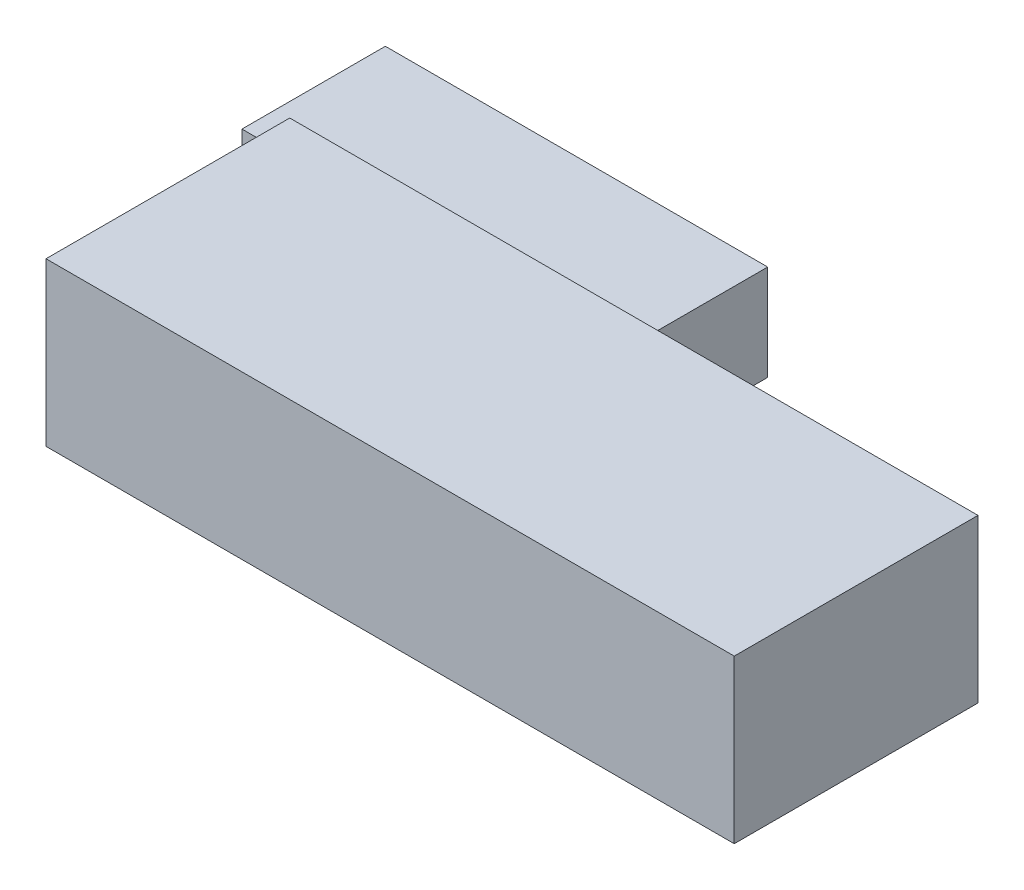
from build123d import *

# Parameters (mm, degrees)
SKETCH1_W           = 144
SKETCH1_H           = 51
BOSS_EXTRUDE1_DEPTH = 34
SKETCH2_W           = 80
SKETCH2_H           = 20
BOSS_EXTRUDE2_DEPTH = 30


with BuildPart() as part:
    # Sketch1 → Boss-Extrude1 (new body)
    with BuildSketch(Plane(origin=(0, 0, 0), x_dir=(1, 0, 0), z_dir=(0, 1, 0))):
        Rectangle(SKETCH1_W, SKETCH1_H)
    extrude(amount=BOSS_EXTRUDE1_DEPTH)

    # Sketch2 → Boss-Extrude2 (add)
    with BuildSketch(Plane(origin=(0, 0, -25.5), x_dir=(-1, 0, 0), z_dir=(0, 0, -1))):
        with Locations((42, 17)):
            Rectangle(SKETCH2_W, SKETCH2_H)
    extrude(amount=BOSS_EXTRUDE2_DEPTH)


solid = part.part
